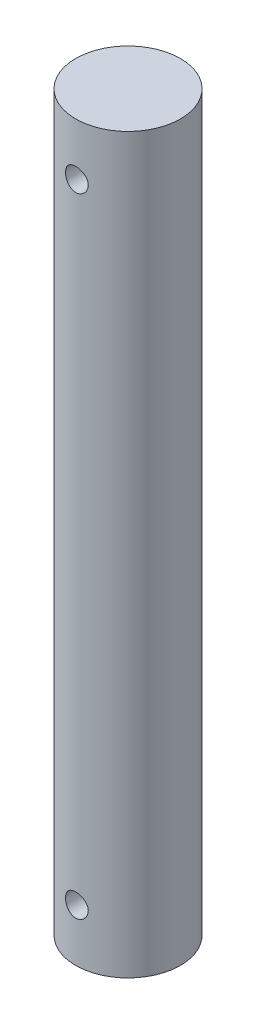
from build123d import *

# Parameters (mm, degrees)
SKETCH1_W          = 15
SKETCH1_H          = 210
SKETCH3_R          = 3.25
CUT_EXTRUDE1_DEPTH = 212.068709192


with BuildPart() as part:
    # Sketch1 → Revolve1 (revolve)
    with BuildSketch(Plane.XY, mode=Mode.PRIVATE) as revolve1_sk:
        with Locations((-7.5, 105)):
            Rectangle(SKETCH1_W, SKETCH1_H)
    revolve(revolve1_sk.sketch.rotate(Axis((0, 0, 0), (0, 1, 0)), 270), axis=Axis((0, 0, 0), (0, 1, 0)))

    # Sketch3 → Cut-Extrude1 (cut, symmetric)
    with BuildSketch(Plane.XY):
        with Locations((0, 195)):
            Circle(SKETCH3_R)
    cut_extrude1 = extrude(amount=CUT_EXTRUDE1_DEPTH, both=True, mode=Mode.SUBTRACT)

    # Mirror1: Cut-Extrude1 across plane
    add(cut_extrude1.mirror(Plane.ZX.offset(105)), mode=Mode.SUBTRACT)


solid = part.part
